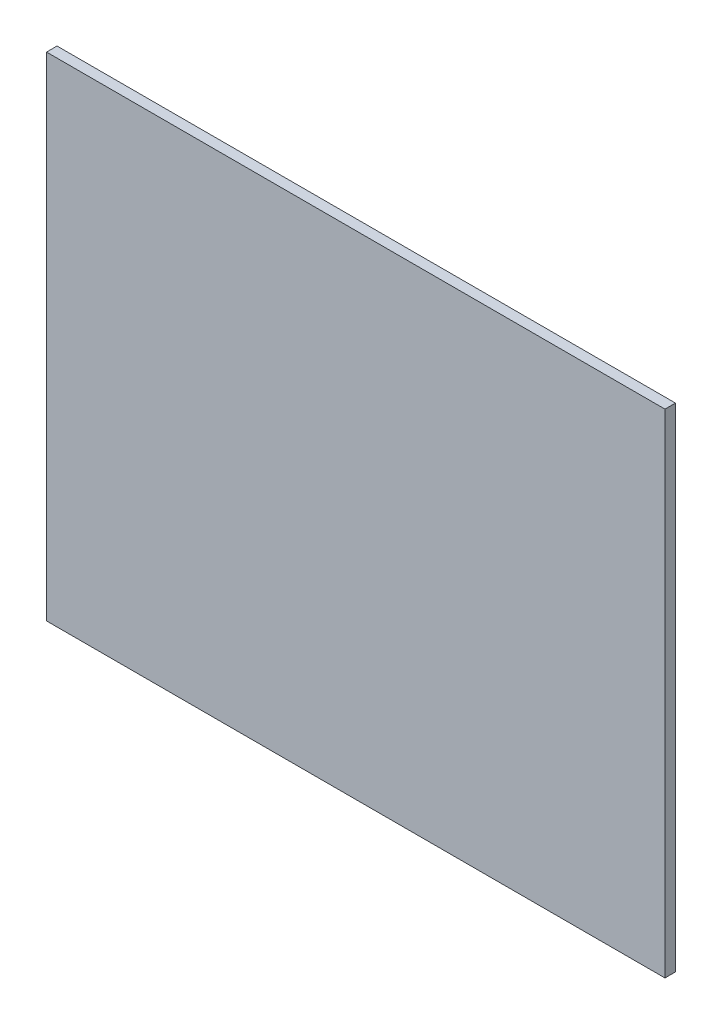
from build123d import *

# Parameters (mm, degrees)
ESQUISSE1_W        = 295
ESQUISSE1_H        = 235
BOSS_EXTRU_1_DEPTH = 5


with BuildPart() as part:
    # Esquisse1 → Boss.-Extru.1 (new body)
    with BuildSketch(Plane.XY):
        with Locations((-147.5, -117.5)):
            Rectangle(ESQUISSE1_W, ESQUISSE1_H)
    extrude(amount=BOSS_EXTRU_1_DEPTH)


solid = part.part
